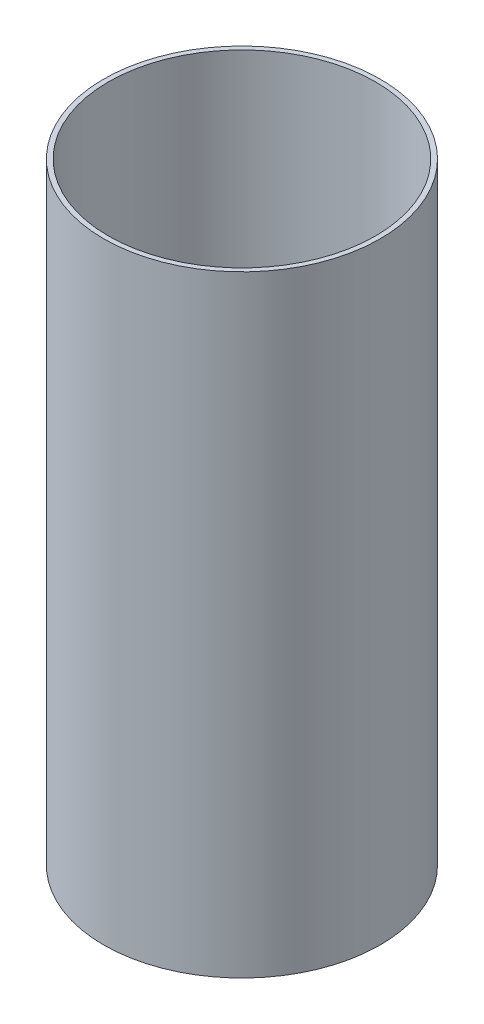
from build123d import *

# Parameters (mm, degrees)
SKETCH1_R           = 92.075
SKETCH1_R_2         = 88.9
BOSS_EXTRUDE1_DEPTH = 203.581


with BuildPart() as part:
    # Sketch1 → Boss-Extrude1 (new, symmetric)
    with BuildSketch(Plane(origin=(0, 0, 0), x_dir=(1, 0, 0), z_dir=(0, 1, 0))):
        with Locations(Location((0, 0, 0), (0, 0, 270))):
            Circle(SKETCH1_R)
        with Locations(Location((0, 0, 0), (0, 0, 270))):
            Circle(SKETCH1_R_2, mode=Mode.SUBTRACT)
    extrude(amount=BOSS_EXTRUDE1_DEPTH, both=True)


solid = part.part
